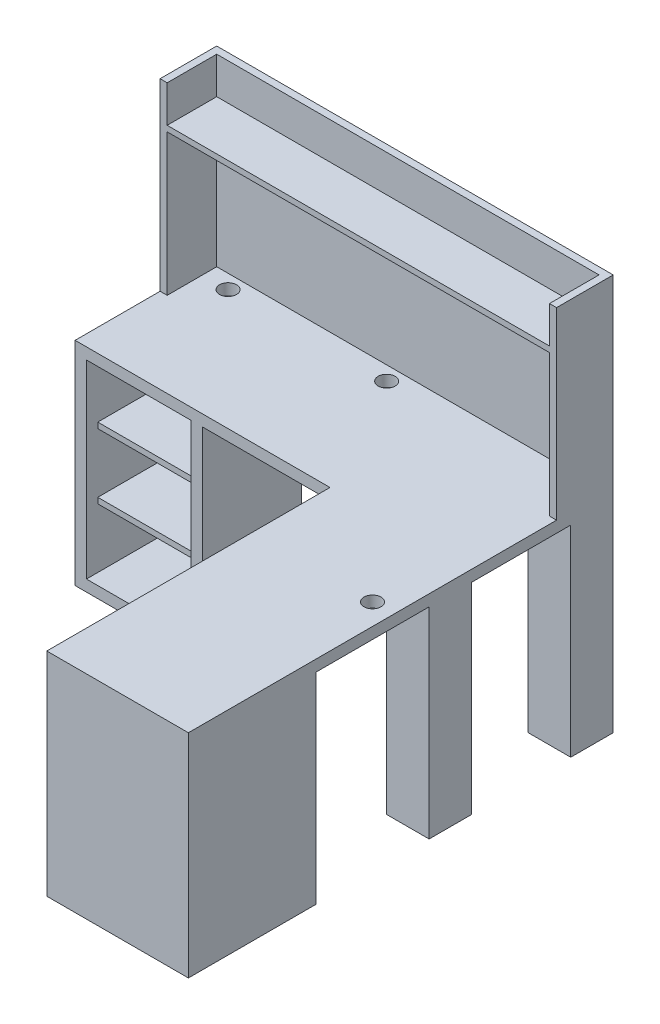
from build123d import *

# Parameters (mm, degrees)
BOSS_EXTRUDE1_DEPTH = 40
SKETCH3_W           = 450
SKETCH3_H           = 500
SKETCH3_W_2         = 500
SKETCH3_H_2         = 450
BOSS_EXTRUDE2_DEPTH = 710
SKETCH5_W           = 410
SKETCH5_H           = 710
CUT_EXTRUDE1_DEPTH  = 150
SKETCH7_R           = 30
CUT_EXTRUDE2_DEPTH  = 150
SKETCH8_W           = 370
SKETCH8_H           = 670
CUT_EXTRUDE3_DEPTH  = 310
SKETCH9_W           = 370
SKETCH9_H           = 670
CUT_EXTRUDE4_DEPTH  = 460
SKETCH10_W          = 150
SKETCH10_H          = 150
BOSS_EXTRUDE3_DEPTH = 710
SKETCH11_W          = 310
SKETCH11_H          = 20
BOSS_EXTRUDE4_DEPTH = 410
SKETCH12_W          = 370
SKETCH12_H          = 670
CUT_EXTRUDE5_DEPTH  = 40
BOSS_EXTRUDE5_DEPTH = 370
SKETCH14_W          = 370
SKETCH14_H          = 670
CUT_EXTRUDE10_DEPTH = 40
BOSS_EXTRUDE6_DEPTH = 650
SKETCH17_W          = 175
SKETCH17_H          = 20
BOSS_EXTRUDE7_DEPTH = 1350


with BuildPart() as part:
    # Sketch2 → Boss-Extrude1 (new body)
    with BuildSketch(Plane(origin=(0, 0, 0), x_dir=(1, 0, 0), z_dir=(0, 1, 0))):
        Polygon((0, 500), (1400, 500), (900, 0), (0, 0), align=None)
        Polygon((900, 0), (1400, 500), (1400, 0), (1400, -1000), (900, -1000), align=None)
    extrude(amount=BOSS_EXTRUDE1_DEPTH)

    # Sketch3 → Boss-Extrude2 (add)
    with BuildSketch(Plane.XZ):
        with Locations((225, -250)):
            Rectangle(SKETCH3_W, SKETCH3_H)
        with Locations((1150, 775)):
            Rectangle(SKETCH3_W_2, SKETCH3_H_2)
    extrude(amount=BOSS_EXTRUDE2_DEPTH)

    # Sketch5 → Cut-Extrude1 (cut)
    with BuildSketch(Plane(origin=(0, 0, -500), x_dir=(-1, 0, 0), z_dir=(0, 0, -1))):
        with Locations((-245, -355)):
            Rectangle(SKETCH5_W, SKETCH5_H)
    extrude(amount=-CUT_EXTRUDE1_DEPTH, mode=Mode.SUBTRACT)

    # Sketch7 → Cut-Extrude2 (cut)
    with BuildSketch(Plane.XZ):
        with Locations(Location((115, -425, 0), (0, 0, 270))):
            Circle(SKETCH7_R)
        with Locations(Location((675, -425, 0), (0, 0, 270))):
            Circle(SKETCH7_R)
        with Locations(Location((1325, 275, 0), (0, 0, 270))):
            Circle(SKETCH7_R)
    extrude(amount=-CUT_EXTRUDE2_DEPTH, mode=Mode.SUBTRACT)

    # Sketch8 → Cut-Extrude3 (cut)
    with BuildSketch(Plane.XY):
        with Locations((225, -335)):
            Rectangle(SKETCH8_W, SKETCH8_H)
    extrude(amount=-CUT_EXTRUDE3_DEPTH, mode=Mode.SUBTRACT)

    # Sketch9 → Cut-Extrude4 (cut)
    with BuildSketch(Plane.ZY.offset(-900)):
        with Locations((775, -335)):
            Rectangle(SKETCH9_W, SKETCH9_H)
    extrude(amount=-CUT_EXTRUDE4_DEPTH, mode=Mode.SUBTRACT)

    # Sketch10 → Boss-Extrude3 (add)
    with BuildSketch(Plane.XZ):
        with Locations((1325, 75)):
            Rectangle(SKETCH10_W, SKETCH10_H)
        with Locations((1325, -425)):
            Rectangle(SKETCH10_W, SKETCH10_H)
    extrude(amount=BOSS_EXTRUDE3_DEPTH)

    # Sketch11 → Boss-Extrude4 (add)
    with BuildSketch(Plane.ZY.offset(-410)):
        with Locations((-155, -220)):
            Rectangle(SKETCH11_W, SKETCH11_H)
        with Locations((-155, -450)):
            Rectangle(SKETCH11_W, SKETCH11_H)
    extrude(amount=BOSS_EXTRUDE4_DEPTH)

    # Sketch12 → Cut-Extrude5 (cut)
    with BuildSketch(Plane.XY):
        with Locations((225, -335)):
            Rectangle(SKETCH12_W, SKETCH12_H)
    extrude(amount=-CUT_EXTRUDE5_DEPTH, mode=Mode.SUBTRACT)

    # Sketch13 → Boss-Extrude5 (add)
    with BuildSketch(Plane.XY.offset(590)):
        Polygon((1360, -320), (900, -320), (900, -335), (900, -350), (1360, -350), align=None)
    extrude(amount=BOSS_EXTRUDE5_DEPTH)

    # Sketch14 → Cut-Extrude10 (cut)
    with BuildSketch(Plane.ZY.offset(-900)):
        with Locations((775, -335)):
            Rectangle(SKETCH14_W, SKETCH14_H)
    extrude(amount=-CUT_EXTRUDE10_DEPTH, mode=Mode.SUBTRACT)

    # Sketch16 → Boss-Extrude6 (add)
    with BuildSketch(Plane(origin=(0, 40, 0), x_dir=(1, 0, 0), z_dir=(0, 1, 0))):
        Polygon((0, 500), (1400, 500), (1400, 300), (1375, 300), (1375, 475), (25, 475), (25, 300), (0, 300), align=None)
    extrude(amount=BOSS_EXTRUDE6_DEPTH)

    # Sketch17 → Boss-Extrude7 (add)
    with BuildSketch(Plane(origin=(25, 0, 0), x_dir=(0, 0, -1), z_dir=(1, 0, 0))):
        with Locations((387.5, 550)):
            Rectangle(SKETCH17_W, SKETCH17_H)
    extrude(amount=BOSS_EXTRUDE7_DEPTH)


solid = part.part
